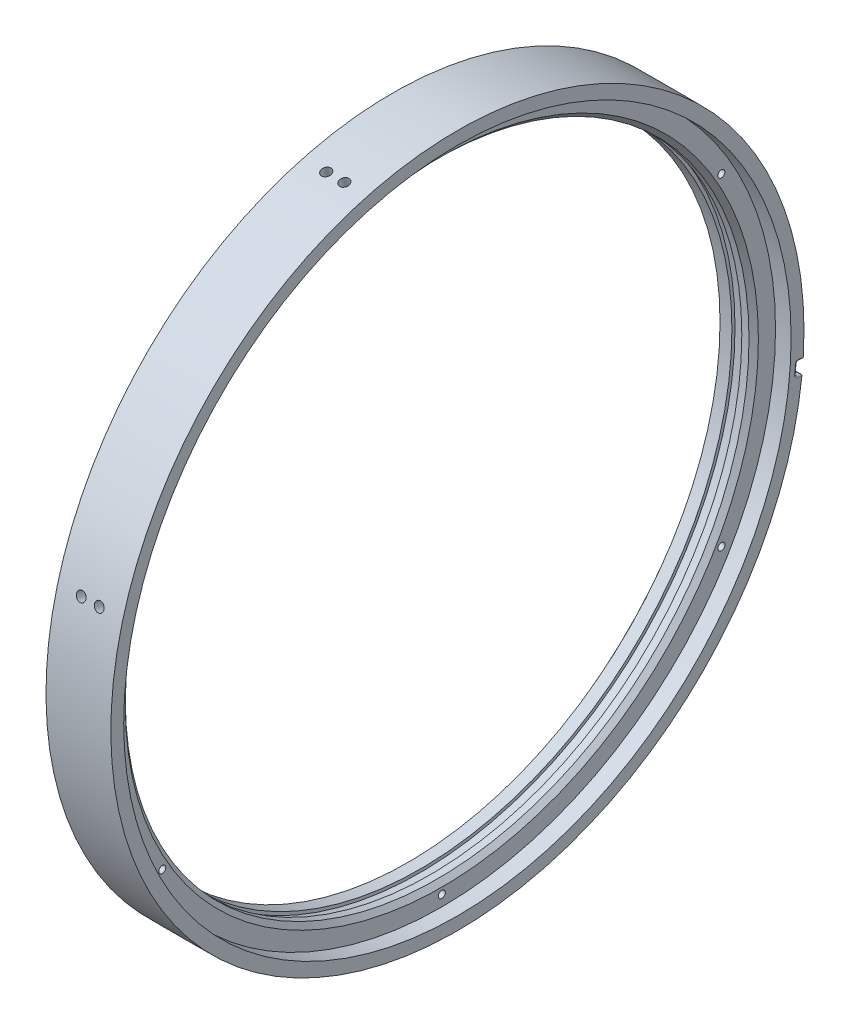
from build123d import *

# Parameters (mm, degrees)
CHAMFER1_SIZE                 = 1.5
TAP_DRILL_FOR_4_40_TAP1_D     = 2.2606
TAP_DRILL_FOR_4_40_TAP1_DEPTH = 8.89
TAP_DRILL_FOR_4_40_TAP1_TIP   = 0.679152758
TAP_DRILL_FOR_4_40_TAP2_D     = 2.2606
TAP_DRILL_FOR_4_40_TAP2_DEPTH = 8.89
TAP_DRILL_FOR_4_40_TAP2_TIP   = 0.679152758
SKETCH8_R                     = 1.524
CUT_EXTRUDE1_DEPTH            = 8.89
CIRPATTERN1_COUNT             = 6
SKETCH12_W                    = 20.7971
SKETCH12_H                    = 4
CUT_EXTRUDE3_DEPTH            = 2
FILLET1_R                     = 0.5


with BuildPart() as part:
    # Sketch3 → Revolve1 (revolve)
    with BuildSketch(Plane(origin=(0, 0, 0), x_dir=(1, 0, 0), z_dir=(0, 1, 0))):
        Polygon((-10.39855, -111.125), (10.39855, -111.125), (10.39855, -107), (5.39855, -107), (5.39855, -100), (1.5875, -100), (1.5875, -101), (-1.5875, -101), (-1.5875, -100), (-5.39855, -100), (-5.39855, -107), (-10.39855, -107), align=None)
    revolve(axis=Axis((0, 0, 0), (-1, 0, 0)))

    # Chamfer1
    chamfer1_edges = [part.edges().sort_by_distance(p)[0] for p in [
        (5.39855, 0, -100),
    ]]
    chamfer(chamfer1_edges, length=CHAMFER1_SIZE)

    # Tap Drill for #4-40 Tap1
    with Locations(Plane(origin=(5.39855, -103.5, 0), x_dir=(0, 0, 1), z_dir=(1, 0, 0))):
        with Locations((0, 0), (89.633629292, -51.75), (-89.633629292, -51.75), (-89.633629292, -155.25), (0, -207), (89.633629292, -155.25)):
            Hole(TAP_DRILL_FOR_4_40_TAP1_D / 2, depth=TAP_DRILL_FOR_4_40_TAP1_DEPTH)
            with Locations((0, 0, -(TAP_DRILL_FOR_4_40_TAP1_DEPTH + TAP_DRILL_FOR_4_40_TAP1_TIP / 2))):  # 118° drill point
                Cone(0, TAP_DRILL_FOR_4_40_TAP1_D / 2, TAP_DRILL_FOR_4_40_TAP1_TIP, mode=Mode.SUBTRACT)

    # Tap Drill for #4-40 Tap2
    with Locations(Plane(origin=(-5.39855, -89.633629292, 51.75), x_dir=(0, 0, -1), z_dir=(-1, 0, 0))):
        with Locations((0, 0), (-51.75, -89.633629292), (0, -179.267258584), (103.5, -179.267258584), (155.25, -89.633629292), (103.5, 0)):
            Hole(TAP_DRILL_FOR_4_40_TAP2_D / 2, depth=TAP_DRILL_FOR_4_40_TAP2_DEPTH)
            with Locations((0, 0, -(TAP_DRILL_FOR_4_40_TAP2_DEPTH + TAP_DRILL_FOR_4_40_TAP2_TIP / 2))):  # 118° drill point
                Cone(0, TAP_DRILL_FOR_4_40_TAP2_D / 2, TAP_DRILL_FOR_4_40_TAP2_TIP, mode=Mode.SUBTRACT)

    # Sketch8 → Cut-Extrude1 (cut)
    with BuildSketch(Plane(origin=(0, 107.338507446, 28.761266387), x_dir=(-1, 0, 0), z_dir=(0, 0.9659258262890681, 0.25881904510252135))):
        with Locations((-2.89855, 0)):
            Circle(SKETCH8_R)
        with Locations((2.89855, 0)):
            Circle(SKETCH8_R)
    cut_extrude1 = extrude(amount=-CUT_EXTRUDE1_DEPTH, mode=Mode.SUBTRACT)

    # CirPattern1: Cut-Extrude1 ×6 about axis
    cirpattern1_axis = Axis((-10.39855, 0, 0), (1, 0, 0))
    for i in range(1, CIRPATTERN1_COUNT):
        add(cut_extrude1.rotate(cirpattern1_axis, i * 360 / CIRPATTERN1_COUNT), mode=Mode.SUBTRACT)

    # Sketch12 → Cut-Extrude3 (cut)
    with BuildSketch(Plane(origin=(10.39855, -9.685181913, -110.702135825), x_dir=(-1, 0, 0), z_dir=(0, -0.08715574274765833, -0.9961946980917457))):
        with Locations((10.39855, 0)):
            Rectangle(SKETCH12_W, SKETCH12_H)
    extrude(amount=-CUT_EXTRUDE3_DEPTH, mode=Mode.SUBTRACT)

    # Fillet1
    fillet1_edges = [part.edges().sort_by_distance(p)[0] for p in [
        (10.39855, -7.604852407, -109.871287255),
        (-10.39855, -7.604852407, -109.871287255),
        (10.39855, -9.510870427, -108.709746429),
        (-10.39855, -9.510870427, -108.709746429),
        (0, -11.676002575, -110.509893624),
        (10.39855, -11.589631199, -109.522664284),
        (0, -11.503259824, -108.535434944),
        (-10.39855, -11.589631199, -109.522664284),
        (0, -7.691223782, -110.858516595),
        (0, -7.518481031, -108.884057915),
    ]]
    fillet(fillet1_edges, radius=FILLET1_R)


solid = part.part
